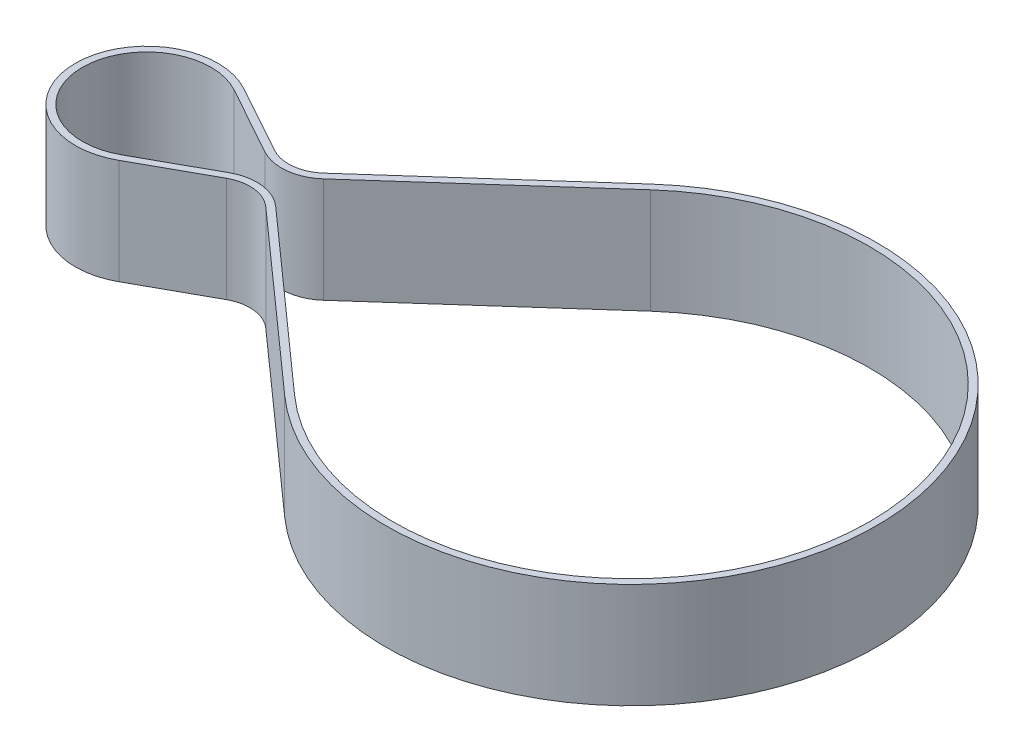
from build123d import *

# Parameters (mm, degrees)
BOSS_EXTRUDE1_DEPTH = 15


with BuildPart() as part:
    # Sketch1 → Boss-Extrude1 (new body)
    with BuildSketch(Plane(origin=(0, 0, 0), x_dir=(1, 0, 0), z_dir=(0, 1, 0))):
        with BuildLine():
            ThreePointArc((-4.666988449, -23.116263327), (53.611641171, 3.020021854), (-4.666988449, 29.156307034))
            Line((-4.666988449, 29.156307034), (-29.36028846, 7.162891325))
            ThreePointArc((-29.36028846, 7.162891325), (-32.406824983, 5.804125188), (-35.678317621, 6.456019442))
            Line((-35.678317621, 6.456019442), (-45.569853208, 11.92154995))
            ThreePointArc((-45.569853208, 11.92154995), (-60.658358829, 3.020021854), (-45.569853208, -5.881506243))
            Line((-45.569853208, -5.881506243), (-35.678317621, -0.415975734))
            ThreePointArc((-35.678317621, -0.415975734), (-32.406824983, 0.235918519), (-29.36028846, -1.122847618))
            Line((-29.36028846, -1.122847618), (-4.666988449, -23.116263327))
        make_face()
        with BuildLine():
            ThreePointArc((-46.053482079, -5.006233077), (-59.658358829, 3.020021854), (-46.053482079, 11.046276784))
            Line((-46.053482079, 11.046276784), (-36.161946493, 5.580746276))
            ThreePointArc((-36.161946493, 5.580746276), (-32.295637011, 4.810325795), (-28.695184757, 6.41614032))
            Line((-28.695184757, 6.41614032), (-4.001884745, 28.409556029))
            ThreePointArc((-4.001884745, 28.409556029), (52.611641171, 3.020021854), (-4.001884745, -22.369512322))
            Line((-4.001884745, -22.369512322), (-28.695184757, -0.376096613))
            ThreePointArc((-28.695184757, -0.376096613), (-32.295637011, 1.229717913), (-36.161946493, 0.459297432))
            Line((-36.161946493, 0.459297432), (-46.053482079, -5.006233077))
        make_face(mode=Mode.SUBTRACT)
    extrude(amount=BOSS_EXTRUDE1_DEPTH)


solid = part.part
